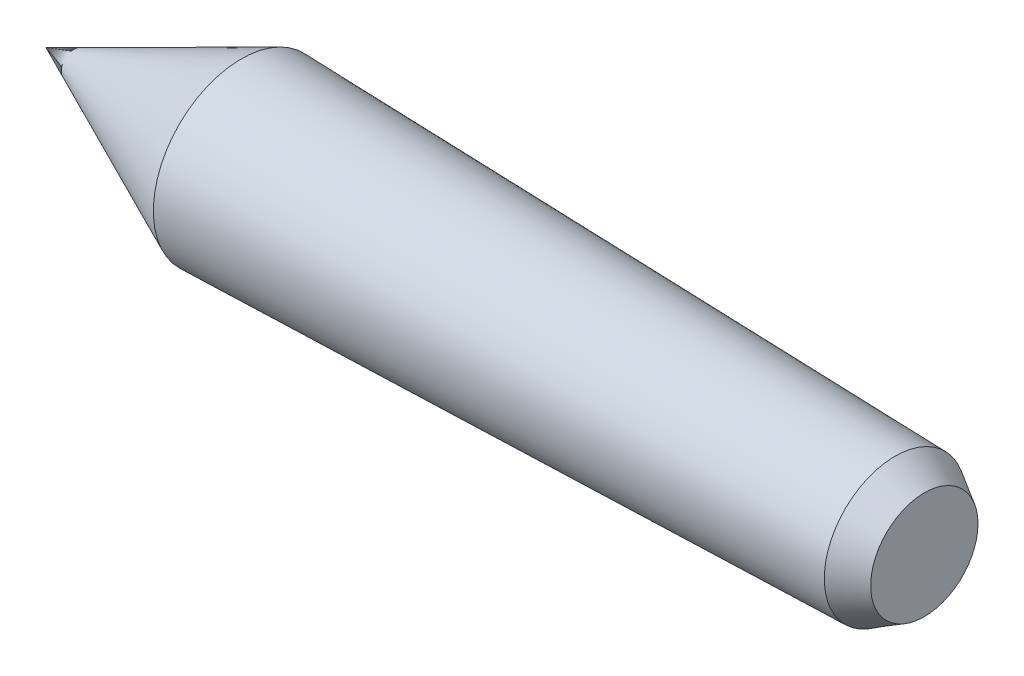
from build123d import *


with BuildPart() as part:
    # Sketch1 → Revolve2 (revolve)
    with BuildSketch(Plane.XY, mode=Mode.PRIVATE) as revolve2_sk:
        Polygon((0, 0), (20, 9), (87, 7.25), (90, 5.5), (90, 0), align=None)
    revolve(revolve2_sk.sketch.rotate(Axis((90, 0, 0), (-1, 0, 0)), 90), axis=Axis((90, 0, 0), (-1, 0, 0)))


solid = part.part
